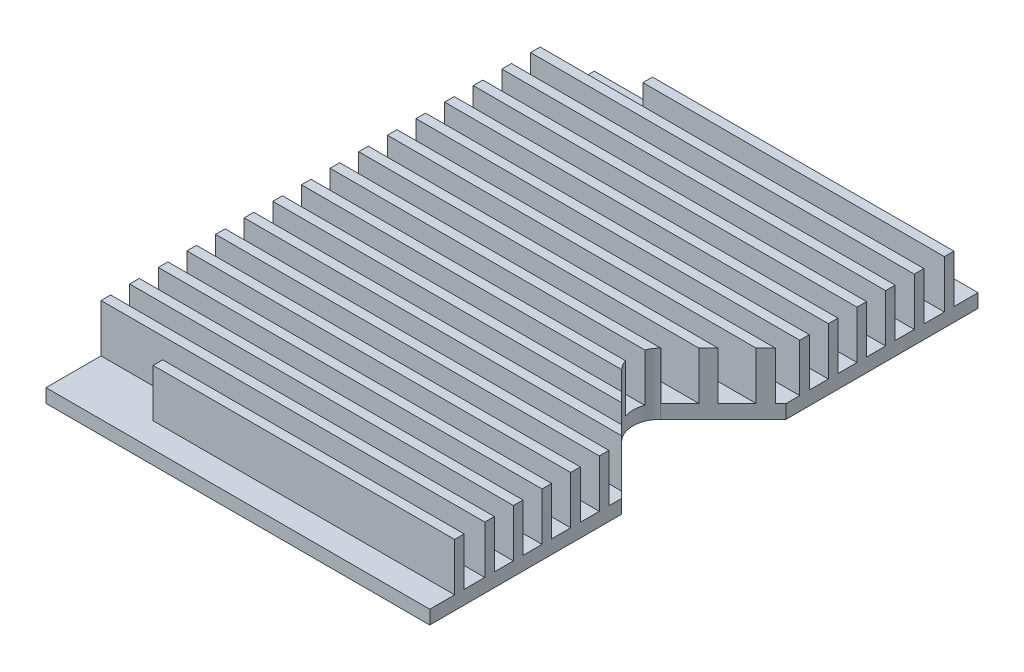
from build123d import *

# Parameters (mm, degrees)
SKETCH_1_W          = 28
SKETCH_1_H          = 40
EXTRUDE_1_DEPTH     = 1
SKETCH_2_W          = 28
SKETCH_2_H          = 0.7
SKETCH_2_W_2        = 22
EXTRUDE_2_DEPTH     = 3.5
CUT_EXTRUDE_1_DEPTH = 25.824383175


with BuildPart() as part:
    # 草图1 → 凸台-拉伸1 (new body)
    with BuildSketch(Plane(origin=(0, 0, 0), x_dir=(1, 0, 0), z_dir=(0, 1, 0))):
        Rectangle(SKETCH_1_W, SKETCH_1_H)
    extrude(amount=EXTRUDE_1_DEPTH)

    # 草图2 → 凸台-拉伸2 (add)
    with BuildSketch(Plane(origin=(0, 1, 0), x_dir=(1, 0, 0), z_dir=(0, 1, 0))):
        with Locations((0, 15.7)):
            Rectangle(SKETCH_2_W, SKETCH_2_H)
        with Locations((0, 13.610934911)):
            Rectangle(SKETCH_2_W, SKETCH_2_H)
        with Locations((0, 11.521869822)):
            Rectangle(SKETCH_2_W, SKETCH_2_H)
        with Locations((0, 9.432804734)):
            Rectangle(SKETCH_2_W, SKETCH_2_H)
        with Locations((0, 7.343739645)):
            Rectangle(SKETCH_2_W, SKETCH_2_H)
        with Locations((0, 5.254674556)):
            Rectangle(SKETCH_2_W, SKETCH_2_H)
        with Locations((0, 3.165609467)):
            Rectangle(SKETCH_2_W, SKETCH_2_H)
        with Locations((0, 1.076544379)):
            Rectangle(SKETCH_2_W, SKETCH_2_H)
        with Locations((0, -1.01252071)):
            Rectangle(SKETCH_2_W, SKETCH_2_H)
        with Locations((0, -3.101585799)):
            Rectangle(SKETCH_2_W, SKETCH_2_H)
        with Locations((0, -5.190650888)):
            Rectangle(SKETCH_2_W, SKETCH_2_H)
        with Locations((0, -7.279715977)):
            Rectangle(SKETCH_2_W, SKETCH_2_H)
        with Locations((0, -9.368781065)):
            Rectangle(SKETCH_2_W, SKETCH_2_H)
        with Locations((0, -11.457846154)):
            Rectangle(SKETCH_2_W, SKETCH_2_H)
        with Locations((0, -13.546911243)):
            Rectangle(SKETCH_2_W, SKETCH_2_H)
        with Locations((0, -15.635976332)):
            Rectangle(SKETCH_2_W, SKETCH_2_H)
        with Locations((3, 17.9)):
            Rectangle(SKETCH_2_W_2, SKETCH_2_H)
        with Locations((3, -17.835976332)):
            Rectangle(SKETCH_2_W_2, SKETCH_2_H)
    extrude(amount=EXTRUDE_2_DEPTH)

    # 草图4 → 切除-拉伸1 (cut, through all)
    with BuildSketch(Plane.XZ):
        with BuildLine():
            Line((9.414213562, -1.414213562), (14, -6))
            Line((14, -6), (14, 6))
            Line((14, 6), (9.414213551, 1.414213551))
            ThreePointArc((9.414213551, 1.414213551), (8.828427125, -8e-09), (9.414213562, -1.414213562))
        make_face()
    extrude(amount=-CUT_EXTRUDE_1_DEPTH, mode=Mode.SUBTRACT)


solid = part.part
